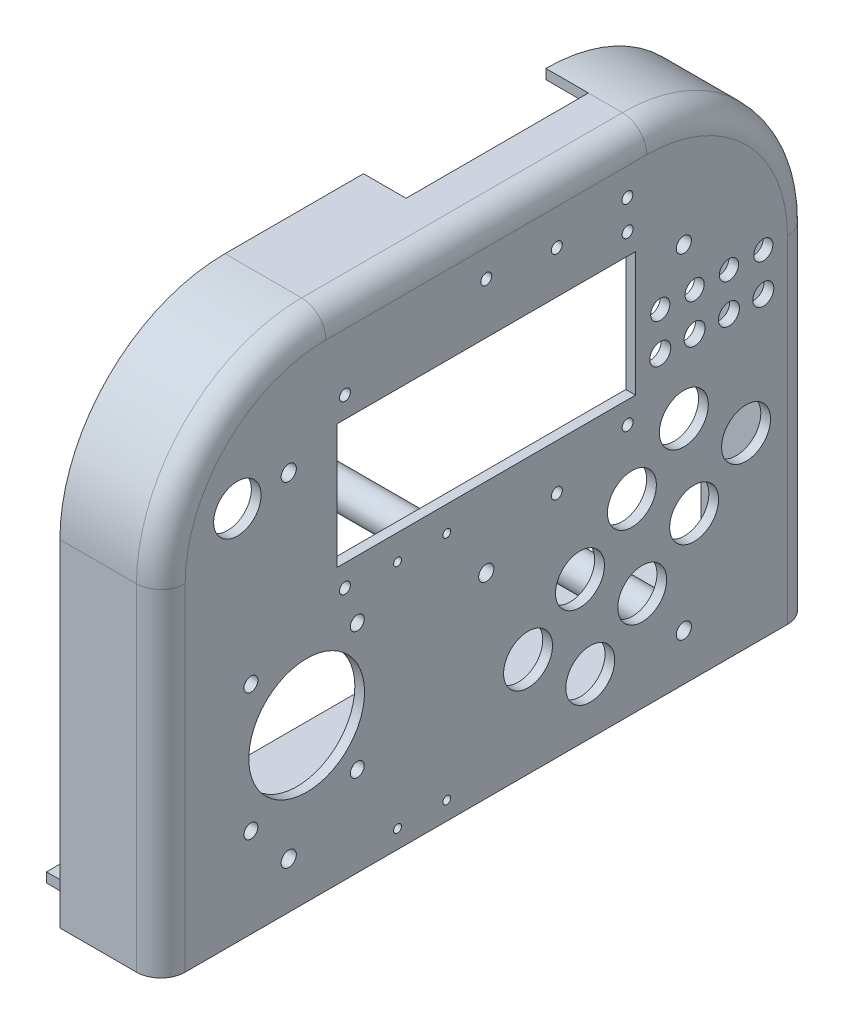
from build123d import *
from build123d.topology import SkipClean

# Parameters (mm, degrees)
SKETCH1_R           = 1.8
SKETCH1_R_2         = 3.15
SKETCH1_R_3         = 8.05
SKETCH1_R_4         = 2.3
SKETCH1_R_5         = 19.05
SKETCH1_R_6         = 2.5
SKETCH1_R_7         = 7.8
SKETCH1_R_8         = 1.3
SKETCH1_R_9         = 3.45
SKETCH1_W           = 98.2
SKETCH1_H           = 40.9
BOSS_EXTRUDE1_DEPTH = 3.2
BOSS_EXTRUDE2_START = 30
BOSS_EXTRUDE2_DEPTH = 30
FILLET1_R           = 4.8
FILLET2_R           = 8
BOSS_EXTRUDE3_START = 50
SKETCH6_R           = 5.25
SKETCH6_R_2         = 2.5
BOSS_EXTRUDE3_DEPTH = 50
SKETCH12_W          = 192.98
SKETCH12_H          = 3.2
BOSS_EXTRUDE7_DEPTH = 15
SKETCH8_R           = 2.3
CUT_EXTRUDE2_DEPTH  = 10
SKETCH19_W          = 14
SKETCH19_H          = 60
CUT_EXTRUDE7_DEPTH  = 10


with BuildPart() as part:
    # Sketch1 → Boss-Extrude1 (new body)
    with BuildSketch(Plane(origin=(0, 0, 0), x_dir=(0, 0, -1), z_dir=(1, 0, 0))):
        with BuildLine():
            Line((-52.79, 54.2), (52.79, 54.2))
            ThreePointArc((52.79, 54.2), (91.185898218, 38.295898218), (107.09, -0.1))
            Line((107.09, -0.1), (107.09, -110.8))
            Line((107.09, -110.8), (-107.09, -110.8))
            Line((-107.09, -110.8), (-107.09, -0.1))
            ThreePointArc((-107.09, -0.1), (-91.185898218, 38.295898218), (-52.79, 54.2))
        make_face()
        with Locations((46.5, 27.4)):
            Circle(SKETCH1_R, mode=Mode.SUBTRACT)
        with Locations((-46.5, -27.6)):
            Circle(SKETCH1_R, mode=Mode.SUBTRACT)
        with Locations((-46.5, 27.4)):
            Circle(SKETCH1_R, mode=Mode.SUBTRACT)
        with Locations((46.5, -27.6)):
            Circle(SKETCH1_R, mode=Mode.SUBTRACT)
        with Locations((57.25, -0.1)):
            Circle(SKETCH1_R_2, mode=Mode.SUBTRACT)
        with Locations((68.55, -0.1)):
            Circle(SKETCH1_R_2, mode=Mode.SUBTRACT)
        with Locations((79.85, -0.1)):
            Circle(SKETCH1_R_2, mode=Mode.SUBTRACT)
        with Locations((91.15, -0.1)):
            Circle(SKETCH1_R_2, mode=Mode.SUBTRACT)
        with Locations((65, -35.1)):
            Circle(SKETCH1_R_3, mode=Mode.SUBTRACT)
        with Locations((85.478801107, -49.439410909)):
            Circle(SKETCH1_R_3, mode=Mode.SUBTRACT)
        with Locations((68.389756641, -63.778821818)):
            Circle(SKETCH1_R_3, mode=Mode.SUBTRACT)
        with Locations((51.300712175, -78.118232726)):
            Circle(SKETCH1_R_3, mode=Mode.SUBTRACT)
        with Locations((34.211667709, -92.457643635)):
            Circle(SKETCH1_R_3, mode=Mode.SUBTRACT)
        with Locations((47.910955534, -49.439410909)):
            Circle(SKETCH1_R_3, mode=Mode.SUBTRACT)
        with Locations((30.821911068, -63.778821818)):
            Circle(SKETCH1_R_3, mode=Mode.SUBTRACT)
        with Locations((13.732866601, -78.118232726)):
            Circle(SKETCH1_R_3, mode=Mode.SUBTRACT)
        with Locations((-77.45, -81.35)):
            Circle(SKETCH1_R_4, mode=Mode.SUBTRACT)
        with Locations((-42.45, -81.35)):
            Circle(SKETCH1_R_4, mode=Mode.SUBTRACT)
        with Locations((-42.45, -39.55)):
            Circle(SKETCH1_R_4, mode=Mode.SUBTRACT)
        with Locations((-77.45, -39.55)):
            Circle(SKETCH1_R_4, mode=Mode.SUBTRACT)
        with Locations((-59.1, -60.45)):
            Circle(SKETCH1_R_5, mode=Mode.SUBTRACT)
        with Locations((-65, -95.5)):
            Circle(SKETCH1_R_6, mode=Mode.SUBTRACT)
        with Locations((65, -95.5)):
            Circle(SKETCH1_R_6, mode=Mode.SUBTRACT)
        with Locations((65, 14.5)):
            Circle(SKETCH1_R_6, mode=Mode.SUBTRACT)
        with Locations((-65, 14.5)):
            Circle(SKETCH1_R_6, mode=Mode.SUBTRACT)
        with Locations((-81.9, 12.7)):
            Circle(SKETCH1_R_7, mode=Mode.SUBTRACT)
        with Locations((0, -46.55)):
            Circle(SKETCH1_R_6, mode=Mode.SUBTRACT)
        with Locations((46.42, 37.2)):
            Circle(SKETCH1_R, mode=Mode.SUBTRACT)
        with Locations((0, 37.2)):
            Circle(SKETCH1_R, mode=Mode.SUBTRACT)
        with Locations((23.21, 34.55)):
            Circle(SKETCH1_R, mode=Mode.SUBTRACT)
        with Locations((23.21, -35.45)):
            Circle(SKETCH1_R, mode=Mode.SUBTRACT)
        with Locations((-29.2, -28.8)):
            Circle(SKETCH1_R_8, mode=Mode.SUBTRACT)
        with Locations((-13, -28.8)):
            Circle(SKETCH1_R_8, mode=Mode.SUBTRACT)
        with Locations((-13, -104.8)):
            Circle(SKETCH1_R_8, mode=Mode.SUBTRACT)
        with Locations((-29.2, -104.8)):
            Circle(SKETCH1_R_8, mode=Mode.SUBTRACT)
        with Locations((91.15, -12.7)):
            Circle(SKETCH1_R_9, mode=Mode.SUBTRACT)
        with Locations((79.85, -12.7)):
            Circle(SKETCH1_R_9, mode=Mode.SUBTRACT)
        with Locations((68.55, -12.7)):
            Circle(SKETCH1_R_9, mode=Mode.SUBTRACT)
        with Locations((57.25, -12.7)):
            Circle(SKETCH1_R_9, mode=Mode.SUBTRACT)
        Rectangle(SKETCH1_W, SKETCH1_H, mode=Mode.SUBTRACT)
    extrude(amount=BOSS_EXTRUDE1_DEPTH)

    # Sketch3 → Boss-Extrude2 (add)
    with BuildSketch(Plane.ZY.offset(BOSS_EXTRUDE2_START)):
        with BuildLine():
            Line((-107.09, -0.1), (-107.09, -110.8))
            Line((-107.09, -110.8), (107.09, -110.8))
            Line((107.09, -110.8), (107.09, -0.1))
            ThreePointArc((107.09, -0.1), (91.185898218, 38.295898218), (52.79, 54.2))
            Line((52.79, 54.2), (-52.79, 54.2))
            ThreePointArc((-52.79, 54.2), (-91.185898218, 38.295898218), (-107.09, -0.1))
        make_face()
        with BuildLine():
            Line((-103.89, -0.1), (-103.89, -107.6))
            Line((-103.89, -107.6), (103.89, -107.6))
            Line((103.89, -107.6), (103.89, -0.1))
            ThreePointArc((103.89, -0.1), (88.923156519, 36.033156519), (52.79, 51))
            Line((52.79, 51), (-52.79, 51))
            ThreePointArc((-52.79, 51), (-88.923156519, 36.033156519), (-103.89, -0.1))
        make_face(mode=Mode.SUBTRACT)
    extrude(amount=-BOSS_EXTRUDE2_DEPTH)

    # Fillet1
    fillet1_edges = [part.edges().sort_by_distance(p)[0] for p in [
        (0, 36.033156519, -88.923156519),
        (0, -53.85, -103.89),
        (0, -53.85, 103.89),
        (0, 36.033156519, 88.923156519),
        (0, 51, 0),
    ]]
    fillet(fillet1_edges, radius=FILLET1_R)

    # Fillet2
    fillet2_edges = [part.edges().sort_by_distance(p)[0] for p in [
        (3.2, 38.295898218, 91.185898218),
        (3.2, -55.45, 107.09),
        (3.2, -55.45, -107.09),
        (3.2, 38.295898218, -91.185898218),
        (3.2, 54.2, 0),
    ]]
    fillet(fillet2_edges, radius=FILLET2_R)

    # Sketch6 → Boss-Extrude3 (add)
    # profile 1 of 5: a face of its own
    with SkipClean():  # the faces are left unmerged after this step: merging them gives an invalid solid
        with BuildSketch(Plane.ZY.offset(BOSS_EXTRUDE3_START)):
            with Locations((65, 14.5)):
                Circle(SKETCH6_R)
            with Locations((65, 14.5)):
                Circle(SKETCH6_R_2, mode=Mode.SUBTRACT)
        # profile 2 of 5: a face of its own
        with BuildSketch(Plane.ZY.offset(BOSS_EXTRUDE3_START)):
            with Locations((-65, 14.5)):
                Circle(SKETCH6_R)
            with Locations((-65, 14.5)):
                Circle(SKETCH6_R_2, mode=Mode.SUBTRACT)
        # profile 3 of 5: a face of its own
        with BuildSketch(Plane.ZY.offset(BOSS_EXTRUDE3_START)):
            with Locations((-65, -95.5)):
                Circle(SKETCH6_R)
            with Locations((-65, -95.5)):
                Circle(SKETCH6_R_2, mode=Mode.SUBTRACT)
        # profile 4 of 5: a face of its own
        with BuildSketch(Plane.ZY.offset(BOSS_EXTRUDE3_START)):
            with Locations((65, -95.5)):
                Circle(SKETCH6_R)
            with Locations((65, -95.5)):
                Circle(SKETCH6_R_2, mode=Mode.SUBTRACT)
        # profile 5 of 5: a face of its own
        with BuildSketch(Plane.ZY.offset(BOSS_EXTRUDE3_START)):
            with Locations((0, -46.55)):
                Circle(SKETCH6_R)
            with Locations((0, -46.55)):
                Circle(SKETCH6_R_2, mode=Mode.SUBTRACT)
        extrude(amount=-BOSS_EXTRUDE3_DEPTH)

    # Sketch12 → Boss-Extrude7 (add)
    with SkipClean():  # the faces are left unmerged after this step: merging them gives an invalid solid
        with BuildSketch(Plane.ZY.offset(30)):
            with Locations((0, -109.2)):
                Rectangle(SKETCH12_W, SKETCH12_H)
        extrude(amount=BOSS_EXTRUDE7_DEPTH)

    # Sketch8 → Cut-Extrude2 (cut)
    with SkipClean():  # the faces are left unmerged after this step: merging them gives an invalid solid
        with BuildSketch(Plane.XZ.offset(110.8)):
            with Locations(Location((-14.6, 77.09, 0), (0, 0, 270))):
                Circle(SKETCH8_R)
            with Locations(Location((-34.6, 77.09, 0), (0, 0, 270))):
                Circle(SKETCH8_R)
            with Locations(Location((-14.6, -77.09, 0), (0, 0, 270))):
                Circle(SKETCH8_R)
            with Locations(Location((-34.6, -77.09, 0), (0, 0, 270))):
                Circle(SKETCH8_R)
        extrude(amount=-CUT_EXTRUDE2_DEPTH, mode=Mode.SUBTRACT)

    # Sketch19 → Cut-Extrude7 (cut)
    with SkipClean():  # the faces are left unmerged after this step: merging them gives an invalid solid
        with BuildSketch(Plane(origin=(0, 54.2, 0), x_dir=(1, 0, 0), z_dir=(0, 1, 0))):
            with Locations((-23, 22.79)):
                Rectangle(SKETCH19_W, SKETCH19_H)
        extrude(amount=-CUT_EXTRUDE7_DEPTH, mode=Mode.SUBTRACT)


solid = part.part
